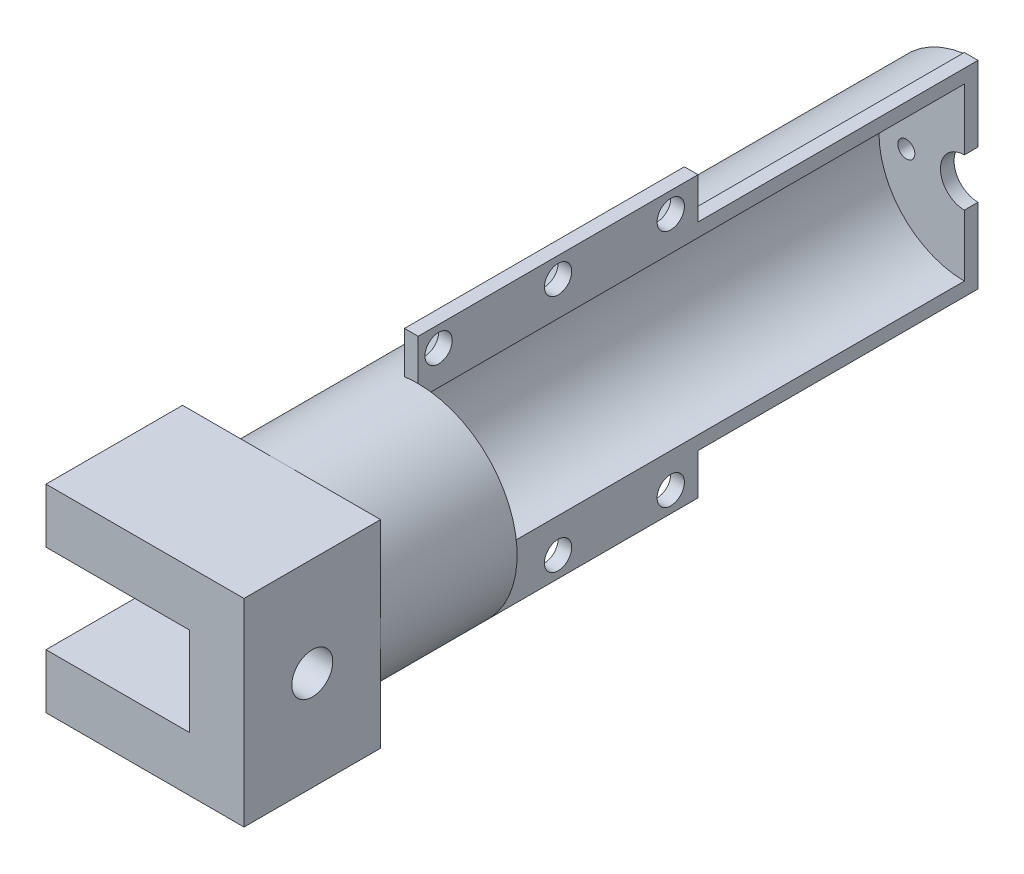
from build123d import *

# Parameters (mm, degrees)
SKETCH1_R           = 14.5
BOSS_EXTRUDE1_DEPTH = 120
CUT_EXTRUDE1_REACH  = 123.739
SKETCH2_R           = 12
SKETCH3_R           = 12.5
CUT_EXTRUDE2_DEPTH  = 80
CUT_EXTRUDE3_DEPTH  = 80
BOSS_EXTRUDE2_START = 2
BOSS_EXTRUDE2_DEPTH = 2
CUT_EXTRUDE4_REACH  = 125.711
CUT_EXTRUDE5_REACH  = 125.711
SKETCH7_R           = 1.25
BOSS_EXTRUDE3_DEPTH = 82
CUT_EXTRUDE6_REACH  = 124.599
SKETCH9_W           = 41
SKETCH9_H           = 6
CUT_EXTRUDE7_REACH  = 124.599
SKETCH10_R          = 2
SKETCH12_W          = 29
SKETCH12_H          = 29
BOSS_EXTRUDE4_DEPTH = 20
CUT_EXTRUDE9_REACH  = 126.557
SKETCH13_W          = 13
SKETCH13_H          = 13
CUT_EXTRUDE10_REACH = 127.145
SKETCH14_W          = 20
SKETCH14_H          = 13
CUT_EXTRUDE11_REACH = 127.145
SKETCH15_R          = 3


with BuildPart() as part:
    # Sketch1 → Boss-Extrude1 (new body)
    with BuildSketch(Plane.XY):
        Circle(SKETCH1_R)
    extrude(amount=BOSS_EXTRUDE1_DEPTH)

    # Sketch2 → Cut-Extrude1 (cut, up to next)
    with BuildSketch(Plane(origin=(0, 0, 0), x_dir=(-1, 0, 0), z_dir=(0, 0, -1)), mode=Mode.PRIVATE) as cut_extrude1_sk1:
        Circle(SKETCH2_R)
    cut_extrude1_tool1 = extrude(cut_extrude1_sk1.sketch, amount=-CUT_EXTRUDE1_REACH, mode=Mode.PRIVATE) & part.part
    add(cut_extrude1_tool1.solids().sort_by_distance((0, 0, 0))[0], mode=Mode.SUBTRACT)

    # Sketch3 → Cut-Extrude2 (cut)
    with BuildSketch(Plane(origin=(0, 0, 0), x_dir=(-1, 0, 0), z_dir=(0, 0, -1))):
        Circle(SKETCH3_R)
    extrude(amount=-CUT_EXTRUDE2_DEPTH, mode=Mode.SUBTRACT)

    # Sketch4 → Cut-Extrude3 (cut)
    with BuildSketch(Plane(origin=(0, 0, 0), x_dir=(-1, 0, 0), z_dir=(0, 0, -1))):
        with BuildLine():
            Line((0, -14.5), (0, 14.5))
            ThreePointArc((0, 14.5), (-14.5, 0), (0, -14.5))
        make_face()
    extrude(amount=-CUT_EXTRUDE3_DEPTH, mode=Mode.SUBTRACT)

    # Sketch5 → Boss-Extrude2 (add)
    with BuildSketch(Plane(origin=(0, 0, 0), x_dir=(-1, 0, 0), z_dir=(0, 0, -1)).offset(BOSS_EXTRUDE2_START)):
        with BuildLine():
            Line((0, -14.5), (0, 14.5))
            ThreePointArc((0, 14.5), (14.5, 0), (0, -14.5))
        make_face()
    extrude(amount=-BOSS_EXTRUDE2_DEPTH)

    # Sketch6 → Cut-Extrude4 (cut, up to next)
    with BuildSketch(Plane(origin=(0, 0, -2), x_dir=(-1, 0, 0), z_dir=(0, 0, -1)), mode=Mode.PRIVATE) as cut_extrude4_sk1:
        with BuildLine():
            Line((0, -3.5), (0, 3.5))
            ThreePointArc((0, 3.5), (3.5, 0), (0, -3.5))
        make_face()
    cut_extrude4_tool1 = extrude(cut_extrude4_sk1.sketch, amount=-CUT_EXTRUDE4_REACH, mode=Mode.PRIVATE) & part.part
    add(cut_extrude4_tool1.solids().sort_by_distance((-1.485446, 0, -2))[0], mode=Mode.SUBTRACT)

    # Sketch7 → Cut-Extrude5 (cut, up to next)
    with BuildSketch(Plane(origin=(0, 0, -2), x_dir=(-1, 0, 0), z_dir=(0, 0, -1)), mode=Mode.PRIVATE) as cut_extrude5_sk1:
        with Locations((8.5, 0)):
            Circle(SKETCH7_R)
    cut_extrude5_tool1 = extrude(cut_extrude5_sk1.sketch, amount=-CUT_EXTRUDE5_REACH, mode=Mode.PRIVATE) & part.part
    add(cut_extrude5_tool1.solids().sort_by_distance((-8.5, 0, -2))[0], mode=Mode.SUBTRACT)

    # Sketch8 → Boss-Extrude3 (add)
    with BuildSketch(Plane(origin=(0, 0, -2), x_dir=(-1, 0, 0), z_dir=(0, 0, -1))):
        with BuildLine():
            Line((0, -14.5), (0, -20.5))
            Line((0, -20.5), (2, -20.5))
            Line((2, -20.5), (2, -14.361406616))
            ThreePointArc((2, -14.361406616), (1.00239814, -14.465310158), (0, -14.5))
        make_face()
    boss_extrude3 = extrude(amount=-BOSS_EXTRUDE3_DEPTH)

    # Sketch9 → Cut-Extrude6 (cut, up to next)
    with BuildSketch(Plane(origin=(0, 0, 0), x_dir=(0, 0, -1), z_dir=(1, 0, 0)), mode=Mode.PRIVATE) as cut_extrude6_sk1:
        with Locations((-18.5, -17.5)):
            Rectangle(SKETCH9_W, SKETCH9_H)
    cut_extrude6_tool1 = extrude(cut_extrude6_sk1.sketch, amount=-CUT_EXTRUDE6_REACH, mode=Mode.PRIVATE) & part.part
    cut_extrude6 = cut_extrude6_tool1.solids().sort_by_distance((0, -17.5, 18.5))[0]
    add(cut_extrude6, mode=Mode.SUBTRACT)

    # Sketch10 → Cut-Extrude7 (cut, up to next)
    with BuildSketch(Plane(origin=(0, 0, 0), x_dir=(0, 0, -1), z_dir=(1, 0, 0)), mode=Mode.PRIVATE) as cut_extrude7_sk1:
        with Locations((-77, -17.5)):
            Circle(SKETCH10_R)
    cut_extrude7_tool1 = extrude(cut_extrude7_sk1.sketch, amount=-CUT_EXTRUDE7_REACH, mode=Mode.PRIVATE) & part.part
    # Sketch10 → Cut-Extrude7 (cut, up to next)
    with BuildSketch(Plane(origin=(0, 0, 0), x_dir=(0, 0, -1), z_dir=(1, 0, 0)), mode=Mode.PRIVATE) as cut_extrude7_sk2:
        with Locations((-59.5, -17.5)):
            Circle(SKETCH10_R)
    cut_extrude7_tool2 = extrude(cut_extrude7_sk2.sketch, amount=-CUT_EXTRUDE7_REACH, mode=Mode.PRIVATE) & part.part
    # Sketch10 → Cut-Extrude7 (cut, up to next)
    with BuildSketch(Plane(origin=(0, 0, 0), x_dir=(0, 0, -1), z_dir=(1, 0, 0)), mode=Mode.PRIVATE) as cut_extrude7_sk3:
        with Locations((-43, -17.5)):
            Circle(SKETCH10_R)
    cut_extrude7_tool3 = extrude(cut_extrude7_sk3.sketch, amount=-CUT_EXTRUDE7_REACH, mode=Mode.PRIVATE) & part.part
    cut_extrude7_1 = cut_extrude7_tool1.solids().sort_by_distance((0, -17.5, 77))[0]
    add(cut_extrude7_1, mode=Mode.SUBTRACT)
    cut_extrude7_2 = cut_extrude7_tool2.solids().sort_by_distance((0, -17.5, 59.5))[0]
    add(cut_extrude7_2, mode=Mode.SUBTRACT)
    cut_extrude7_3 = cut_extrude7_tool3.solids().sort_by_distance((0, -17.5, 43))[0]
    add(cut_extrude7_3, mode=Mode.SUBTRACT)
    cut_extrude7 = cut_extrude7_1 + cut_extrude7_2 + cut_extrude7_3  # Cut-Extrude7 as one shape, for the pattern or mirror that repeats it

    # Mirror1: Boss-Extrude3, Cut-Extrude6, Cut-Extrude7 across plane
    add(boss_extrude3.mirror(Plane.ZX))
    add(cut_extrude6.mirror(Plane.ZX), mode=Mode.SUBTRACT)
    add(cut_extrude7.mirror(Plane.ZX), mode=Mode.SUBTRACT)

    # Sketch12 → Boss-Extrude4 (add)
    with BuildSketch(Plane.XY.offset(120)):
        Rectangle(SKETCH12_W, SKETCH12_H)
    extrude(amount=-BOSS_EXTRUDE4_DEPTH)

    # Sketch13 → Cut-Extrude9 (cut, up to next)
    with BuildSketch(Plane.XY.offset(120), mode=Mode.PRIVATE) as cut_extrude9_sk1:
        Rectangle(SKETCH13_W, SKETCH13_H)
    cut_extrude9_tool1 = extrude(cut_extrude9_sk1.sketch, amount=-CUT_EXTRUDE9_REACH, mode=Mode.PRIVATE) & part.part
    add(cut_extrude9_tool1.solids().sort_by_distance((0, 0, 120))[0], mode=Mode.SUBTRACT)

    # Sketch14 → Cut-Extrude10 (cut, up to next)
    with BuildSketch(Plane.ZY.offset(14.5), mode=Mode.PRIVATE) as cut_extrude10_sk1:
        with Locations((110, 0)):
            Rectangle(SKETCH14_W, SKETCH14_H)
    cut_extrude10_tool1 = extrude(cut_extrude10_sk1.sketch, amount=-CUT_EXTRUDE10_REACH, mode=Mode.PRIVATE) & part.part
    add(cut_extrude10_tool1.solids().sort_by_distance((-14.5, 0, 110))[0], mode=Mode.SUBTRACT)

    # Sketch15 → Cut-Extrude11 (cut, up to next)
    with BuildSketch(Plane(origin=(14.5, 0, 0), x_dir=(0, 0, -1), z_dir=(1, 0, 0)), mode=Mode.PRIVATE) as cut_extrude11_sk1:
        with Locations(Location((-110, 0, 0), (0, 0, 90))):
            Circle(SKETCH15_R)
    cut_extrude11_tool1 = extrude(cut_extrude11_sk1.sketch, amount=-CUT_EXTRUDE11_REACH, mode=Mode.PRIVATE) & part.part
    add(cut_extrude11_tool1.solids().sort_by_distance((14.5, 0, 110))[0], mode=Mode.SUBTRACT)


solid = part.part
